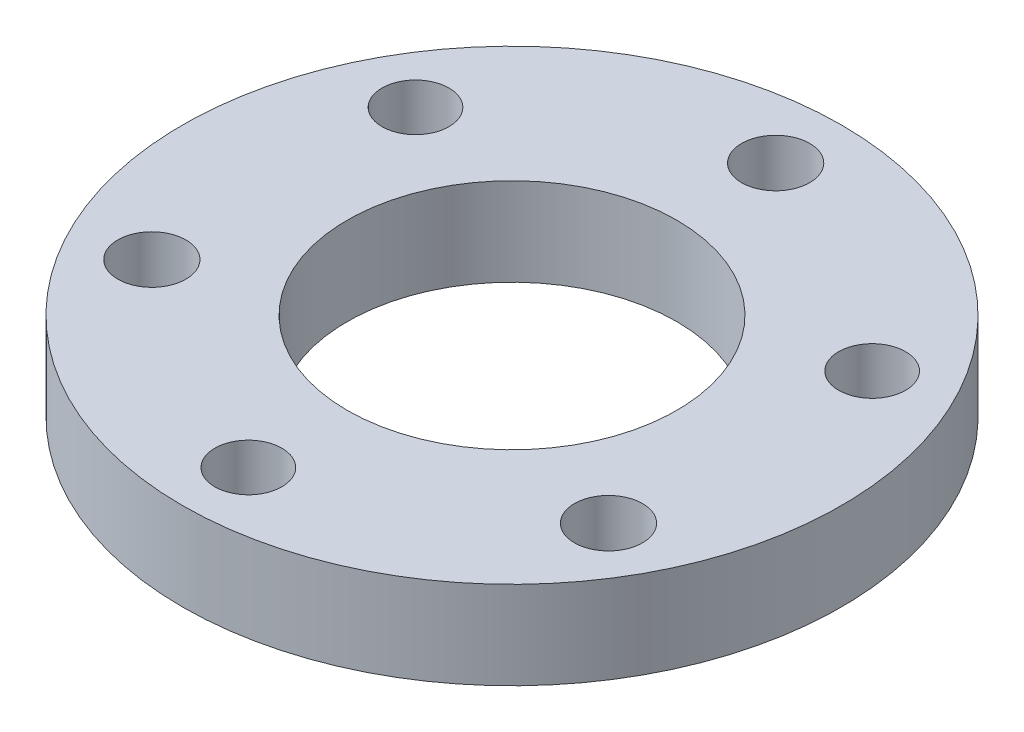
from build123d import *

# Parameters (mm, degrees)
SKETCH_1_R      = 15
SKETCH_1_R_2    = 1.55
SKETCH_1_R_3    = 7.5
SKETCH_1_R_4    = 1.525
EXTRUDE_1_DEPTH = 4


with BuildPart() as part:
    # 草图1 → 凸台-拉伸1 (new body)
    with BuildSketch(Plane(origin=(0, 0, 0), x_dir=(1, 0, 0), z_dir=(0, 1, 0))):
        with Locations(Location((0, 0, 0), (0, 0, 270))):
            Circle(SKETCH_1_R)
        with Locations(Location((0, 12, 0), (0, 0, 270))):
            Circle(SKETCH_1_R_2, mode=Mode.SUBTRACT)
        with Locations(Location((10.392304845, -6, 0), (0, 0, 270))):
            Circle(SKETCH_1_R_2, mode=Mode.SUBTRACT)
        with Locations(Location((-10.392304845, -6, 0), (0, 0, 270))):
            Circle(SKETCH_1_R_2, mode=Mode.SUBTRACT)
        with Locations(Location((0, 0, 0), (0, 0, 270))):
            Circle(SKETCH_1_R_3, mode=Mode.SUBTRACT)
        with Locations(Location((-10.392304845, 6, 0), (0, 0, 270))):
            Circle(SKETCH_1_R_4, mode=Mode.SUBTRACT)
        with Locations(Location((10.392304845, 6, 0), (0, 0, 270))):
            Circle(SKETCH_1_R_4, mode=Mode.SUBTRACT)
        with Locations(Location((0, -12, 0), (0, 0, 270))):
            Circle(SKETCH_1_R_4, mode=Mode.SUBTRACT)
    extrude(amount=EXTRUDE_1_DEPTH)


solid = part.part
